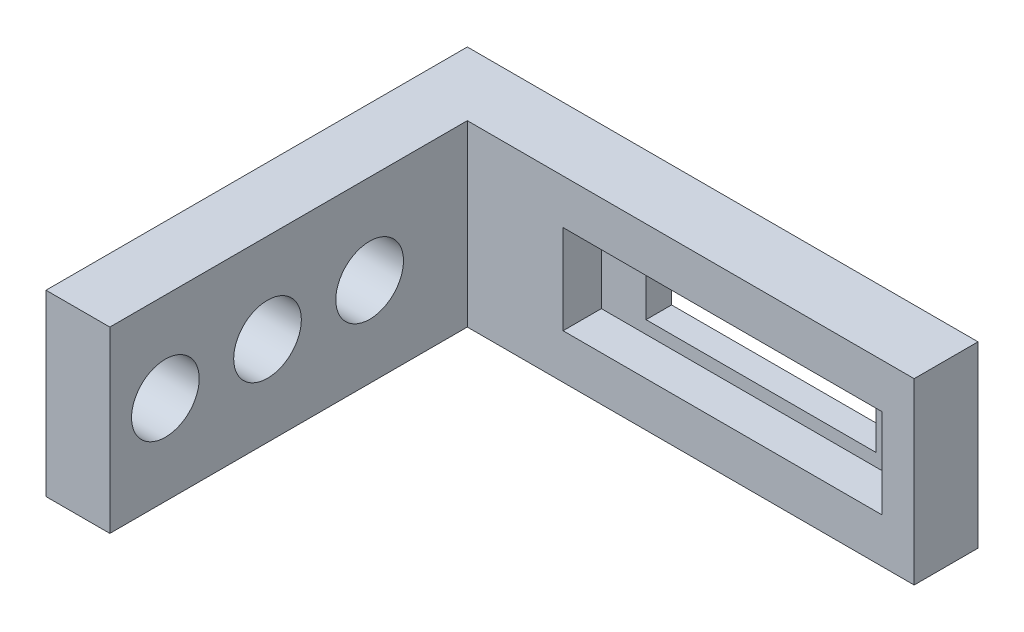
from build123d import *

# Parameters (mm, degrees)
BOSS_EXTRUDE1_DEPTH  = 14
SKETCH2_W            = 25
SKETCH2_H            = 7
CUT_EXTRUDE3_DEPTH   = 3
SKETCH10_W           = 18
SKETCH10_H           = 5
CUT_EXTRUDE4_DEPTH   = 43.95346319
SKETCH20_W           = 24
SKETCH20_H           = 14
BOSS_EXTRUDE10_DEPTH = 5
SKETCH21_R           = 2.65
CUT_EXTRUDE13_DEPTH  = 5
SKETCH22_W           = 5
SKETCH22_H           = 4
CUT_EXTRUDE14_DEPTH  = 49.703182648
SKETCH23_R           = 2.65
BOSS_EXTRUDE11_DEPTH = 5


with BuildPart() as part:
    # Sketch1 → Boss-Extrude1 (new body)
    with BuildSketch(Plane(origin=(0, 0, 0), x_dir=(1, 0, 0), z_dir=(0, 1, 0))):
        Polygon((6.589095597, 0), (10, 0), (10, 4), (40, 4), (40, 9), (11.589095597, 9), (0, 9), (0, 0), align=None)
    extrude(amount=BOSS_EXTRUDE1_DEPTH)

    # Sketch2 → Cut-Extrude3 (cut)
    with BuildSketch(Plane.XY.offset(-4)):
        with Locations((25, 7)):
            Rectangle(SKETCH2_W, SKETCH2_H)
    extrude(amount=-CUT_EXTRUDE3_DEPTH, mode=Mode.SUBTRACT)

    # Sketch10 → Cut-Extrude4 (cut, through all)
    with BuildSketch(Plane.XY.offset(-7)):
        with Locations((25, 7)):
            Rectangle(SKETCH10_W, SKETCH10_H)
    extrude(amount=-CUT_EXTRUDE4_DEPTH, mode=Mode.SUBTRACT)

    # Sketch20 → Boss-Extrude10 (add)
    with BuildSketch(Plane.ZY):
        with Locations((12, 7)):
            Rectangle(SKETCH20_W, SKETCH20_H)
    extrude(amount=-BOSS_EXTRUDE10_DEPTH)

    # Sketch21 → Cut-Extrude13 (cut)
    with BuildSketch(Plane.ZY):
        with Locations((-4.35, 7)):
            Circle(SKETCH21_R)
        with Locations((3.65, 7)):
            Circle(SKETCH21_R)
        with Locations((11.65, 7)):
            Circle(SKETCH21_R)
        with Locations((19.65, 7)):
            Circle(SKETCH21_R)
    extrude(amount=-CUT_EXTRUDE13_DEPTH, mode=Mode.SUBTRACT)

    # Sketch22 → Cut-Extrude14 (cut, through all)
    with BuildSketch(Plane(origin=(0, 14, 0), x_dir=(1, 0, 0), z_dir=(0, 1, 0))):
        with Locations((7.5, 2)):
            Rectangle(SKETCH22_W, SKETCH22_H)
    extrude(amount=-CUT_EXTRUDE14_DEPTH, mode=Mode.SUBTRACT)

    # Sketch23 → Boss-Extrude11 (add)
    with BuildSketch(Plane.ZY):
        with Locations((-4.35, 7)):
            Circle(SKETCH23_R)
    extrude(amount=-BOSS_EXTRUDE11_DEPTH)


solid = part.part
